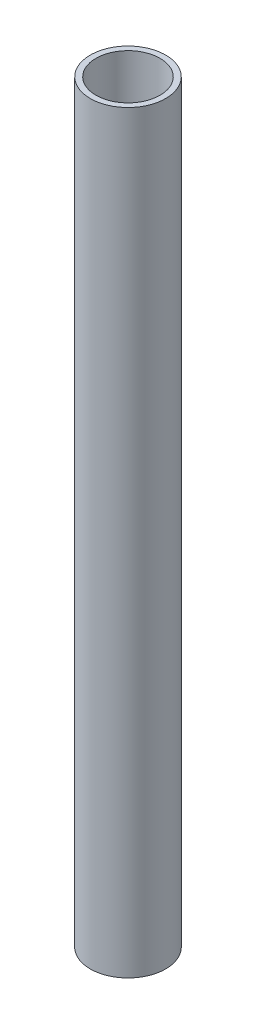
from build123d import *

# Parameters (mm, degrees)
SKETCH_1_R      = 16
SKETCH_1_R_2    = 13.6
EXTRUDE_1_DEPTH = 320


with BuildPart() as part:
    # 草图1 → 凸台-拉伸1 (new body)
    with BuildSketch(Plane(origin=(0, 0, 0), x_dir=(1, 0, 0), z_dir=(0, 1, 0))):
        with Locations(Location((0, 0, 0), (0, 0, 270))):
            Circle(SKETCH_1_R)
        with Locations(Location((0, 0, 0), (0, 0, 270))):
            Circle(SKETCH_1_R_2, mode=Mode.SUBTRACT)
    extrude(amount=EXTRUDE_1_DEPTH)


solid = part.part
